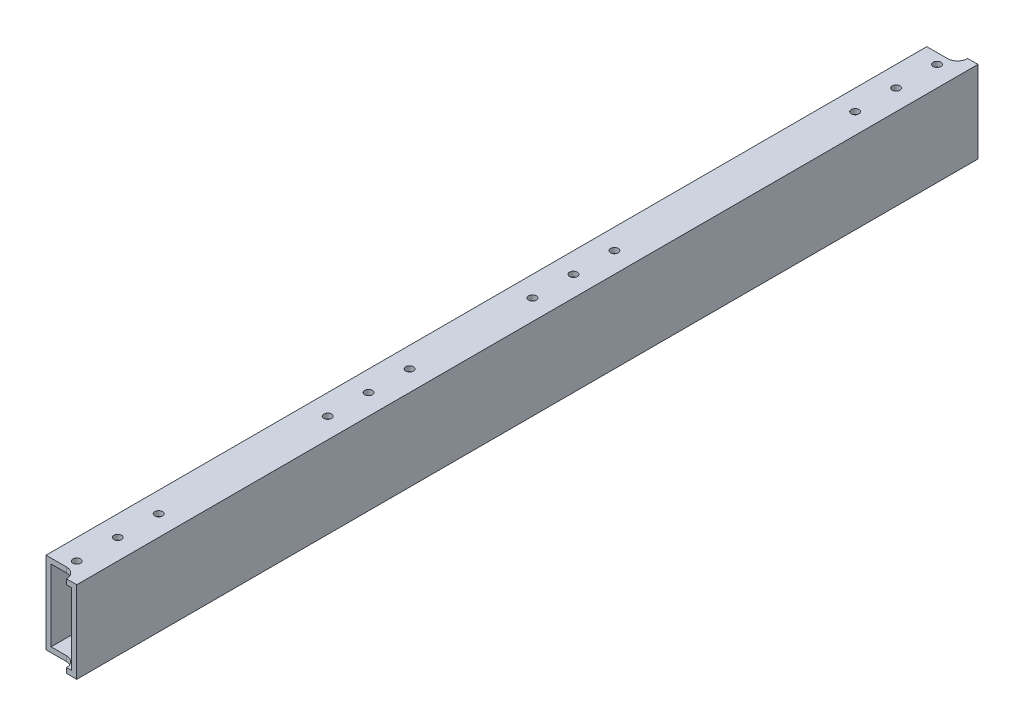
from build123d import *

# Parameters (mm, degrees)
SKETCH1_W           = 25.4
SKETCH1_H           = 50.8
BOSS_EXTRUDE1_DEPTH = 279.4
SHELL1_T            = -3.175
SKETCH3_R           = 2.38125
CUT_EXTRUDE1_DEPTH  = 285.264471927


with BuildPart() as part:
    # Sketch1 → Boss-Extrude1 (new, symmetric)
    with BuildSketch(Plane.XY):
        Rectangle(SKETCH1_W, SKETCH1_H)
    extrude(amount=BOSS_EXTRUDE1_DEPTH, both=True)

    # Shell1
    shell1_openings = [part.faces().sort_by_distance(p)[0] for p in [
        (0, 0, 279.4),
        (0, 0, -279.4),
    ]]
    offset(amount=SHELL1_T, openings=shell1_openings, kind=Kind.INTERSECTION)

    # Sketch3 → Cut-Extrude1 (cut, through all)
    with BuildSketch(Plane(origin=(0, 25.4, 0), x_dir=(1, 0, 0), z_dir=(0, 1, 0))):
        with Locations(Location((0, 266.7, 0), (0, 0, 270))):
            Circle(SKETCH3_R)
        with Locations(Location((0, 241.3, 0), (0, 0, 270))):
            Circle(SKETCH3_R)
        with Locations(Location((0, 215.9, 0), (0, 0, 270))):
            Circle(SKETCH3_R)
        with Locations(Location((0, -215.9, 0), (0, 0, 270))):
            Circle(SKETCH3_R)
        with Locations(Location((0, -241.3, 0), (0, 0, 270))):
            Circle(SKETCH3_R)
        with Locations(Location((0, -266.7, 0), (0, 0, 270))):
            Circle(SKETCH3_R)
        with Locations(Location((0, 66.675, 0), (0, 0, 270))):
            Circle(SKETCH3_R)
        with Locations(Location((0, 15.875, 0), (0, 0, 270))):
            Circle(SKETCH3_R)
        with Locations(Location((0, 41.275, 0), (0, 0, 270))):
            Circle(SKETCH3_R)
        with Locations(Location((0, -85.725, 0), (0, 0, 270))):
            Circle(SKETCH3_R)
        with Locations(Location((0, -60.325, 0), (0, 0, 270))):
            Circle(SKETCH3_R)
        with Locations(Location((0, -111.125, 0), (0, 0, 270))):
            Circle(SKETCH3_R)
        with BuildLine():
            Line((6.35, 279.4), (-12.7, 279.4))
            Line((-12.7, 279.4), (-12.7, 273.05))
            Line((-12.7, 273.05), (0, 273.05))
            ThreePointArc((0, 273.05), (4.490128061, 274.909871939), (6.35, 279.4))
        make_face()
        with BuildLine():
            Line((-12.7, -273.05), (0, -273.05))
            ThreePointArc((0, -273.05), (4.490128061, -274.909871939), (6.35, -279.4))
            Line((6.35, -279.4), (-12.7, -279.4))
            Line((-12.7, -279.4), (-12.7, -273.05))
        make_face()
    extrude(amount=-CUT_EXTRUDE1_DEPTH, mode=Mode.SUBTRACT)


solid = part.part
